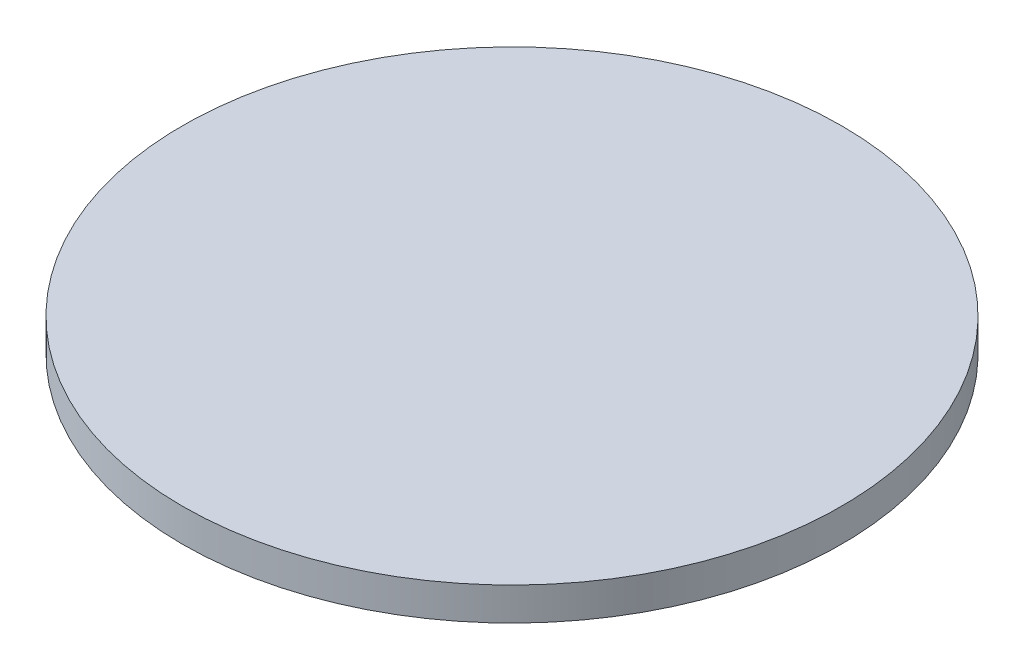
from build123d import *

# Parameters (mm, degrees)
SKETCH_1_R      = 50
EXTRUDE_1_DEPTH = 5


with BuildPart() as part:
    # 草图1 → 凸台-拉伸1 (new body)
    with BuildSketch(Plane(origin=(0, 0, 0), x_dir=(1, 0, 0), z_dir=(0, 1, 0))):
        with Locations(Location((0, 0, 0), (0, 0, 270))):
            Circle(SKETCH_1_R)
    extrude(amount=EXTRUDE_1_DEPTH)


solid = part.part
